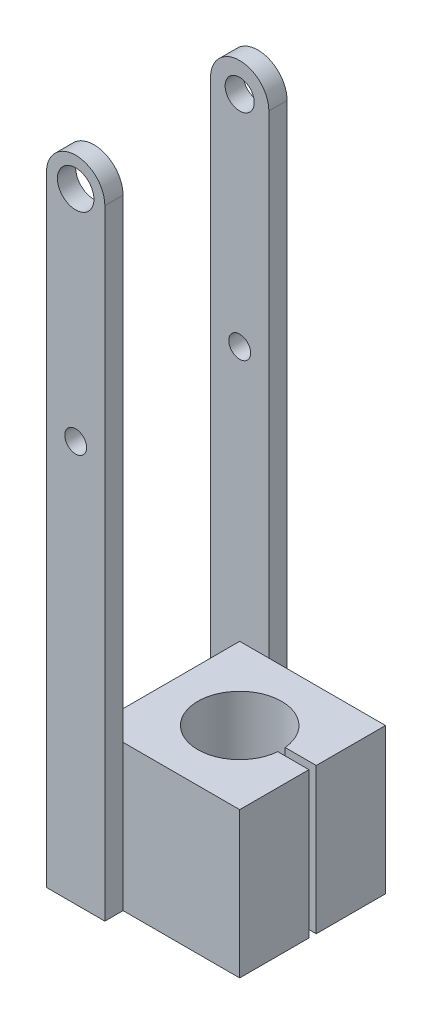
from build123d import *

# Parameters (mm, degrees)
EXTRUDE1_DEPTH = 40
SKETCH3_R      = 5
SKETCH3_R_2    = 3
EXTRUDE2_DEPTH = 5
EXTRUDE3_START = 5
SKETCH4_R      = 4
SKETCH4_R_2    = 3
EXTRUDE3_DEPTH = 5


with BuildPart() as part:
    # Sketch2 → Extrude1 (new body)
    with BuildSketch(Plane(origin=(0, 0, 0), x_dir=(1, 0, 0), z_dir=(0, 1, 0))):
        with BuildLine():
            Line((-20, 20), (20, 20))
            Line((20, 20), (20, 1))
            Line((20, 1), (11.456439237, 1))
            ThreePointArc((11.456439237, 1), (-11.5, 0), (11.456439237, -1))
            Line((11.456439237, -1), (20, -1))
            Line((20, -1), (20, -20))
            Line((20, -20), (-20, -20))
            Line((-20, -20), (-20, 20))
        make_face()
    extrude(amount=EXTRUDE1_DEPTH)

    # Sketch3 → Extrude2 (add)
    with BuildSketch(Plane.XY.offset(20)):
        with BuildLine():
            Line((-28, 170), (-28, 0))
            Line((-28, 0), (-12, 0))
            Line((-12, 0), (-12, 170))
            ThreePointArc((-12, 170), (-20, 178), (-28, 170))
        make_face()
        with Locations((-20, 170)):
            Circle(SKETCH3_R, mode=Mode.SUBTRACT)
        with Locations((-20, 110)):
            Circle(SKETCH3_R_2, mode=Mode.SUBTRACT)
    extrude(amount=EXTRUDE2_DEPTH)

    # Sketch4 → Extrude3 (add)
    with BuildSketch(Plane(origin=(0, 0, -20), x_dir=(-1, 0, 0), z_dir=(0, 0, -1)).offset(EXTRUDE3_START)):
        with BuildLine():
            Line((12, 0), (28, 0))
            Line((28, 0), (28, 170))
            ThreePointArc((28, 170), (20, 178), (12, 170))
            Line((12, 170), (12, 0))
        make_face()
        with Locations((20, 170)):
            Circle(SKETCH4_R, mode=Mode.SUBTRACT)
        with Locations(Location((20, 110, 0), (0, 0, 180))):
            Circle(SKETCH4_R_2, mode=Mode.SUBTRACT)
    extrude(amount=-EXTRUDE3_DEPTH)


solid = part.part
